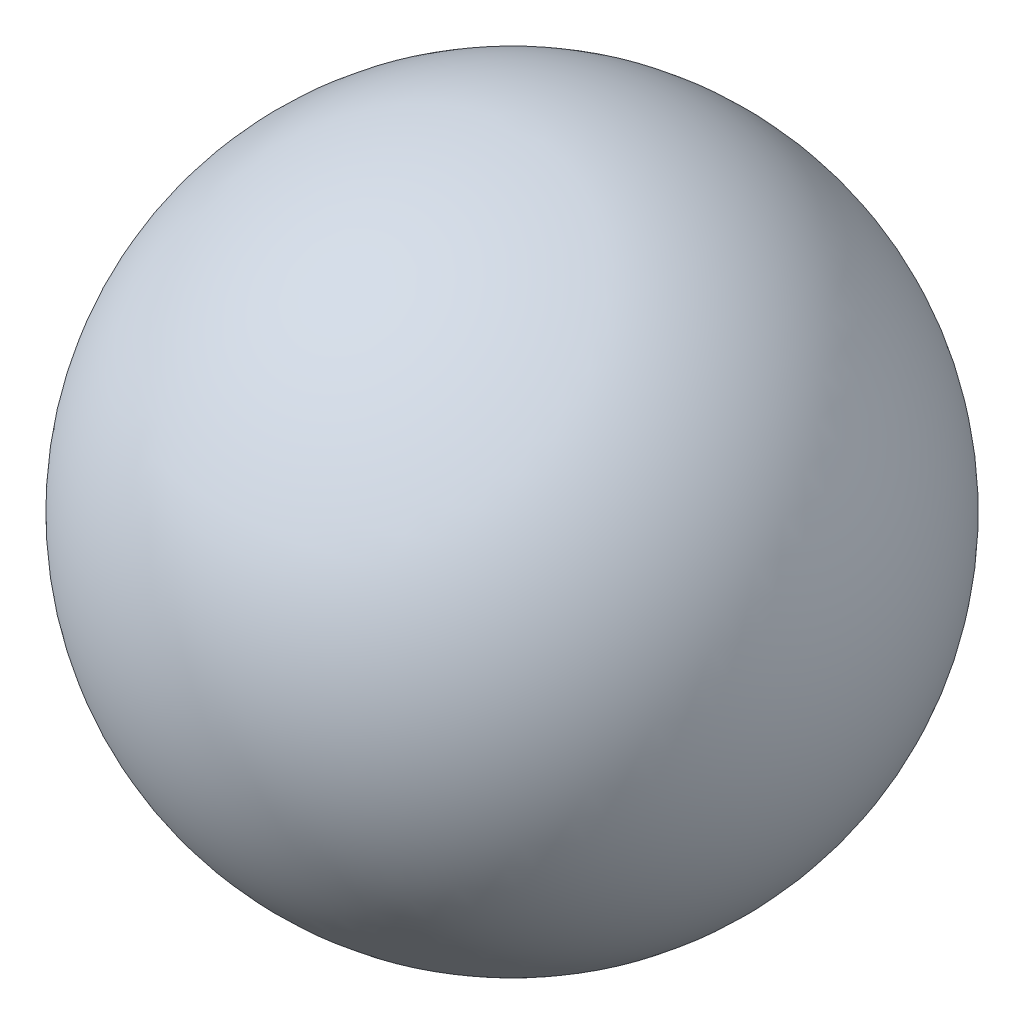
from build123d import *


with BuildPart() as part:
    # Sketch1 → Revolve1 (revolve)
    with BuildSketch(Plane.XY):
        with BuildLine():
            Line((0, 17.3), (0, -17.3))
            ThreePointArc((0, -17.3), (17.3, 0), (0, 17.3))
        make_face()
    revolve(axis=Axis((0, 41.077437207, 0), (0, -1, 0)))


solid = part.part
